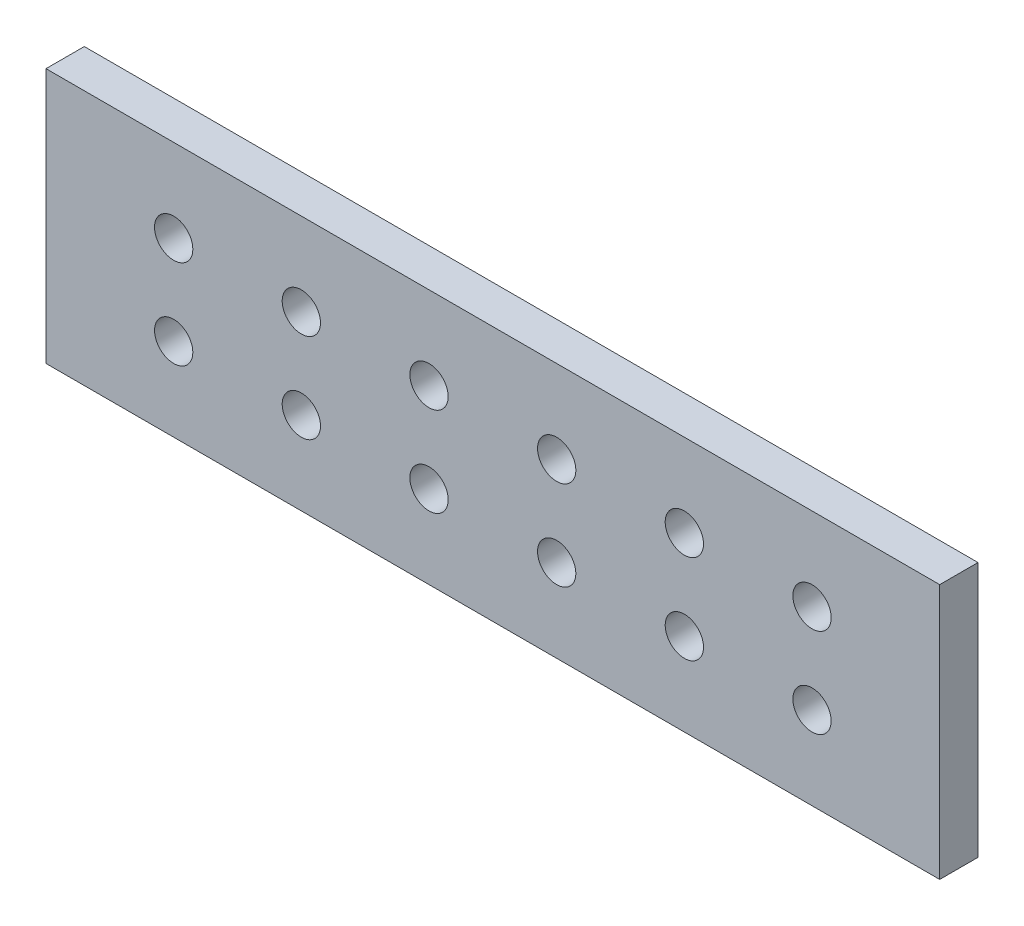
from build123d import *

# Parameters (mm, degrees)
SKETCH1_W           = 70
SKETCH1_H           = 20
SKETCH1_R           = 1.5
BOSS_EXTRUDE1_DEPTH = 3


with BuildPart() as part:
    # Sketch1 → Boss-Extrude1 (new body)
    with BuildSketch(Plane.XY):
        Rectangle(SKETCH1_W, SKETCH1_H)
        with Locations((-25, 3.5)):
            Circle(SKETCH1_R, mode=Mode.SUBTRACT)
        with Locations((-25, -3.5)):
            Circle(SKETCH1_R, mode=Mode.SUBTRACT)
        with Locations((-15, 3.5)):
            Circle(SKETCH1_R, mode=Mode.SUBTRACT)
        with Locations((-5, 3.5)):
            Circle(SKETCH1_R, mode=Mode.SUBTRACT)
        with Locations((5, 3.5)):
            Circle(SKETCH1_R, mode=Mode.SUBTRACT)
        with Locations((15, 3.5)):
            Circle(SKETCH1_R, mode=Mode.SUBTRACT)
        with Locations((25, 3.5)):
            Circle(SKETCH1_R, mode=Mode.SUBTRACT)
        with Locations((-15, -3.5)):
            Circle(SKETCH1_R, mode=Mode.SUBTRACT)
        with Locations((-5, -3.5)):
            Circle(SKETCH1_R, mode=Mode.SUBTRACT)
        with Locations((5, -3.5)):
            Circle(SKETCH1_R, mode=Mode.SUBTRACT)
        with Locations((15, -3.5)):
            Circle(SKETCH1_R, mode=Mode.SUBTRACT)
        with Locations((25, -3.5)):
            Circle(SKETCH1_R, mode=Mode.SUBTRACT)
    extrude(amount=BOSS_EXTRUDE1_DEPTH)


solid = part.part
